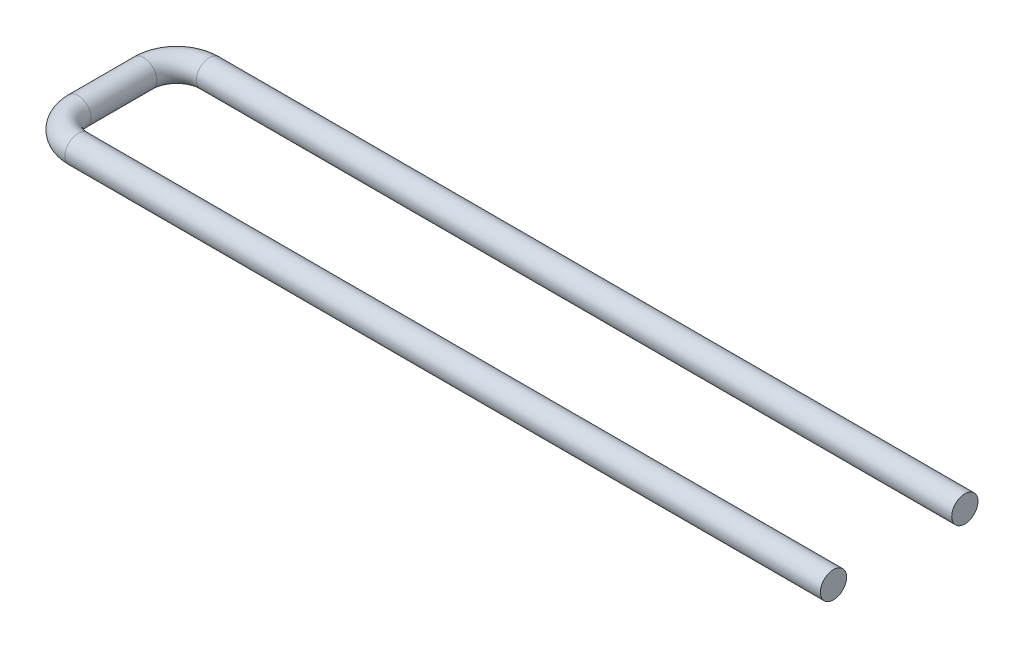
from build123d import *

# Parameters (mm, degrees)
SZKIC2_R = 2


with BuildPart() as part:
    # Wyciągnięcie po ścieżce1: sweep along a path in Szkic1
    with BuildLine(Plane(origin=(0, 0, 0), x_dir=(1, 0, 0), z_dir=(0, 1, 0))) as wyci_gni_cie_po_cie_ce1_path:
        Line((0, 0), (-115, 0))
        ThreePointArc((-115, 0), (-118.535533906, 1.464466094), (-120, 5))
        Line((-120, 5), (-120, 15))
        ThreePointArc((-120, 15), (-118.535533906, 18.535533906), (-115, 20))
        Line((-115, 20), (0, 20))
    # Szkic2 → Wyciągnięcie po ścieżce1 (sweep)
    with BuildSketch(Plane(origin=(0, 0, 0), x_dir=(0, 0, -1), z_dir=(1, 0, 0))):
        Circle(SZKIC2_R)
    sweep(path=wyci_gni_cie_po_cie_ce1_path.line)


solid = part.part
